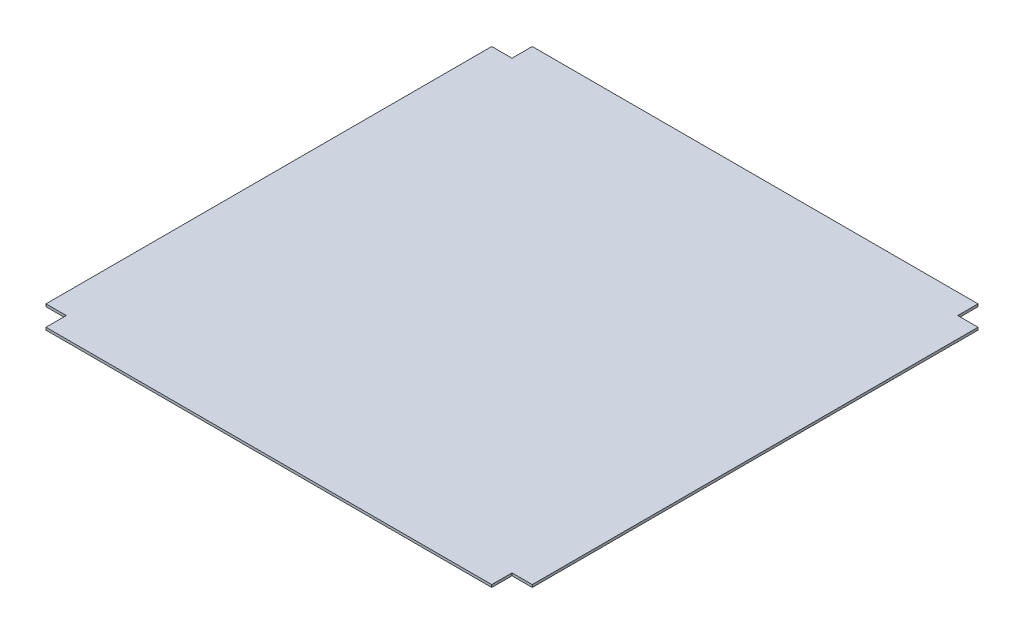
from build123d import *

# Parameters (mm, degrees)
SKETCH1_W           = 1219.2
SKETCH1_H           = 1219.2
BOSS_EXTRUDE1_DEPTH = 3.175
SKETCH2_W           = 50.8
SKETCH2_H           = 50.8
CUT_EXTRUDE1_DEPTH  = 863.127973389


with BuildPart() as part:
    # Sketch1 → Boss-Extrude1 (new, symmetric)
    with BuildSketch(Plane(origin=(0, 0, 0), x_dir=(1, 0, 0), z_dir=(0, 1, 0))):
        Rectangle(SKETCH1_W, SKETCH1_H)
    extrude(amount=BOSS_EXTRUDE1_DEPTH, both=True)

    # Sketch2 → Cut-Extrude1 (cut, through all)
    with BuildSketch(Plane(origin=(0, 3.175, 0), x_dir=(1, 0, 0), z_dir=(0, 1, 0))):
        with Locations((-584.2, 584.2)):
            Rectangle(SKETCH2_W, SKETCH2_H)
        with Locations((584.2, 584.2)):
            Rectangle(SKETCH2_W, SKETCH2_H)
        with Locations((584.2, -584.2)):
            Rectangle(SKETCH2_W, SKETCH2_H)
        with Locations((-584.2, -584.2)):
            Rectangle(SKETCH2_W, SKETCH2_H)
    extrude(amount=-CUT_EXTRUDE1_DEPTH, mode=Mode.SUBTRACT)


solid = part.part
